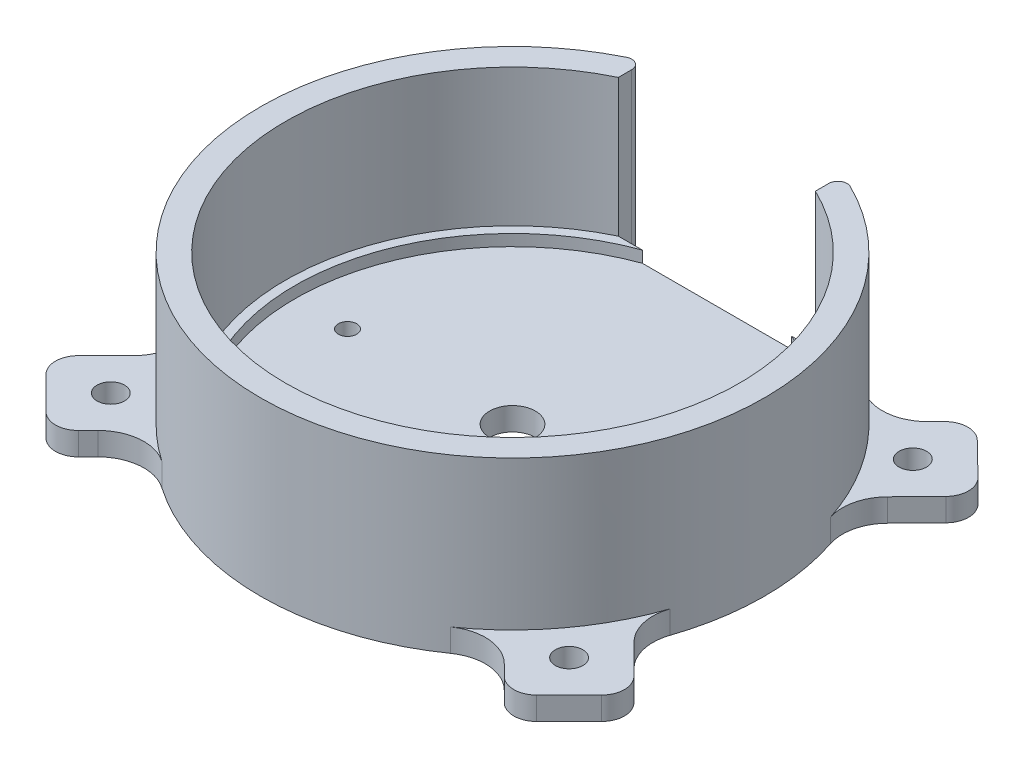
from build123d import *

# Parameters (mm, degrees)
SKETCH_1_R          = 55
EXTRUDE_1_DEPTH     = 37.5
SKETCH_3_R          = 49.5
CUT_EXTRUDE_1_DEPTH = 32.5
SKETCH_5_W          = 43
SKETCH_5_H          = 12.242897151
CUT_EXTRUDE_2_DEPTH = 40
FILLET_4_R          = 2
FILLET_5_R          = 2
SKETCH_6_R          = 5
CUT_EXTRUDE_3_DEPTH = 12
EXTRUDE_START       = -5
EXTRUDE_3_DEPTH     = 5
FILLET_7_R          = 10
FILLET_8_R          = 5
SKETCH_10_R         = 3
CUT_EXTRUDE_5_DEPTH = 5
EXTRUDE_START_2     = 2.5
EXTRUDE_4_DEPTH     = 2.5
SKETCH_16_R         = 2
CUT_EXTRUDE_6_DEPTH = 10


with BuildPart() as part:
    # 草图1 → 凸台-拉伸1 (new body)
    with BuildSketch(Plane(origin=(0, 0, 0), x_dir=(1, 0, 0), z_dir=(0, 1, 0))):
        with Locations(Location((0, 0, 0), (0, 0, 270))):
            Circle(SKETCH_1_R)
    extrude(amount=EXTRUDE_1_DEPTH)

    # 草图3 → 切除-拉伸1 (cut)
    with BuildSketch(Plane(origin=(0, 37.5, 0), x_dir=(1, 0, 0), z_dir=(0, 1, 0))):
        with Locations(Location((0, 0, 0), (0, 0, 270))):
            Circle(SKETCH_3_R)
    extrude(amount=-CUT_EXTRUDE_1_DEPTH, mode=Mode.SUBTRACT)

    # 草图5 → 切除-拉伸2 (cut)
    with BuildSketch(Plane(origin=(0, 37.5, 0), x_dir=(1, 0, 0), z_dir=(0, 1, 0))):
        with Locations((0, 50.708442195)):
            Rectangle(SKETCH_5_W, SKETCH_5_H)
    extrude(amount=-CUT_EXTRUDE_2_DEPTH, mode=Mode.SUBTRACT)

    # 圆角4
    fillet_4_edges = [part.edges().sort_by_distance(p)[0] for p in [
        (-21.5, 18.75, -50.623611092),
    ]]
    fillet(fillet_4_edges, radius=FILLET_4_R)

    # 圆角5
    fillet_5_edges = [part.edges().sort_by_distance(p)[0] for p in [
        (21.5, 18.75, -50.623611092),
    ]]
    fillet(fillet_5_edges, radius=FILLET_5_R)

    # 草图6 → 切除-拉伸3 (cut)
    with BuildSketch(Plane(origin=(0, 5, 0), x_dir=(1, 0, 0), z_dir=(0, 1, 0))):
        with Locations(Location((0, 0, 0), (0, 0, 270))):
            Circle(SKETCH_6_R)
    extrude(amount=-CUT_EXTRUDE_3_DEPTH, mode=Mode.SUBTRACT)

    # 草图14 → 凸台-拉伸3 (add)
    with BuildSketch(Plane(origin=(0, 5, 0), x_dir=(1, 0, 0), z_dir=(0, 1, 0)).offset(EXTRUDE_START)):
        with BuildLine():
            Line((-49.898576095, 23.132922507), (-63.862525635, 37.044772973))
            Line((-63.862525635, 37.044772973), (-49.746845912, 51.213315099))
            Line((-49.746845912, 51.213315099), (-38.128637352, 39.638453724))
            ThreePointArc((-38.128637352, 39.638453724), (-44.78063998, 31.932652301), (-49.898576095, 23.132922507))
        make_face()
        with BuildLine():
            Line((49.811900188, -23.3189751), (64.421720913, -37.928795825))
            Line((64.421720913, -37.928795825), (50.279585289, -52.070931449))
            Line((50.279585289, -52.070931449), (37.984884655, -39.776230814))
            ThreePointArc((37.984884655, -39.776230814), (44.662950793, -32.097053236), (49.811900188, -23.3189751))
        make_face()
        with BuildLine():
            Line((-49.632393674, -23.698639164), (-63.862550335, -37.928795825))
            Line((-63.862550335, -37.928795825), (-49.720414711, -52.070931449))
            Line((-49.720414711, -52.070931449), (-37.697852746, -40.048369484))
            ThreePointArc((-37.697852746, -40.048369484), (-44.423770724, -32.427281642), (-49.632393674, -23.698639164))
        make_face()
        with BuildLine():
            Line((38.475737251, 39.301623923), (50.118901666, 51.212426922))
            Line((50.118901666, 51.212426922), (64.420808036, 37.231887798))
            Line((64.420808036, 37.231887798), (50.134465219, 22.6171483))
            ThreePointArc((50.134465219, 22.6171483), (45.083643676, 31.50341367), (38.475737251, 39.301623923))
        make_face()
    extrude(amount=EXTRUDE_3_DEPTH)

    # 圆角7
    fillet_7_edges = [part.edges().sort_by_distance(p)[0] for p in [
        (-38.128637352, 2.5, -39.638453724),
        (-49.898576095, 2.5, -23.132922507),
        (-49.632393674, 2.5, 23.698639164),
        (-37.697852746, 2.5, 40.048369484),
        (50.134465219, 2.5, -22.6171483),
        (38.475737251, 2.5, -39.301623923),
        (37.984884655, 2.5, 39.776230814),
        (49.811900188, 2.5, 23.3189751),
    ]]
    fillet(fillet_7_edges, radius=FILLET_7_R)

    # 圆角8
    fillet_8_edges = [part.edges().sort_by_distance(p)[0] for p in [
        (-63.862525635, 2.5, -37.044772973),
        (-49.746845912, 2.5, -51.213315099),
        (-49.720414711, 2.5, 52.070931449),
        (-63.862550335, 2.5, 37.928795825),
        (50.118901666, 2.5, -51.212426922),
        (64.420808036, 2.5, -37.231887798),
        (50.279585289, 2.5, 52.070931449),
        (64.421720913, 2.5, 37.928795825),
    ]]
    fillet(fillet_8_edges, radius=FILLET_8_R)

    # 草图10 → 切除-拉伸5 (cut)
    with BuildSketch(Plane(origin=(0, 5, 0), x_dir=(1, 0, 0), z_dir=(0, 1, 0))):
        with Locations(Location((-49.720414711, 37.071204175, 0), (0, 0, 270))):
            Circle(SKETCH_10_R)
        with Locations(Location((50.279585289, 37.071204175, 0), (0, 0, 270))):
            Circle(SKETCH_10_R)
        with Locations(Location((-49.720414711, -37.928795825, 0), (0, 0, 270))):
            Circle(SKETCH_10_R)
        with Locations(Location((50.279585289, -37.928795825, 0), (0, 0, 270))):
            Circle(SKETCH_10_R)
    extrude(amount=-CUT_EXTRUDE_5_DEPTH, mode=Mode.SUBTRACT)

    # 草图15 → 凸台-拉伸4 (add)
    with BuildSketch(Plane(origin=(0, 5, 0), x_dir=(1, 0, 0), z_dir=(0, 1, 0)).offset(EXTRUDE_START_2)):
        with BuildLine():
            Line((-21.5, 44.586993619), (-16.255768207, 44.586993619))
            ThreePointArc((-16.255768207, 44.586993619), (0, -47.457876059), (16.255768207, 44.586993619))
            Line((16.255768207, 44.586993619), (21.5, 44.586993619))
            ThreePointArc((21.5, 44.586993619), (0, -49.5), (-21.5, 44.586993619))
        make_face()
    extrude(amount=-EXTRUDE_4_DEPTH)

    # 草图16 → 切除-拉伸6 (cut)
    with BuildSketch(Plane(origin=(0, 0, 0), x_dir=(-1, 0, 0), z_dir=(0, -1, 0))):
        with Locations(Location((36, 0, 0), (0, 0, 90))):
            Circle(SKETCH_16_R)
        with Locations(Location((-36, 0, 0), (0, 0, 90))):
            Circle(SKETCH_16_R)
    extrude(amount=-CUT_EXTRUDE_6_DEPTH, mode=Mode.SUBTRACT)


solid = part.part
